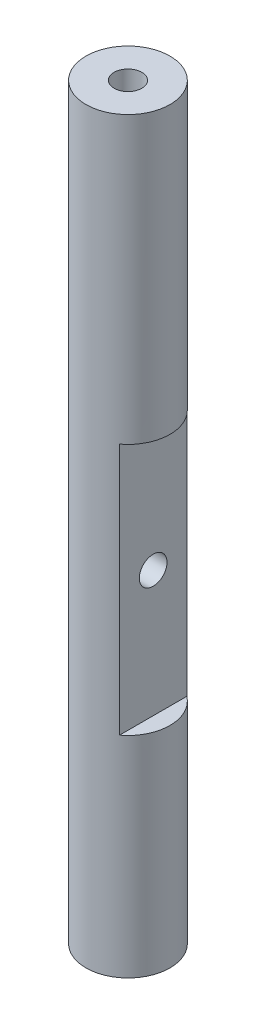
from build123d import *

# Parameters (mm, degrees)
SKETCH_1_R             = 5
EXTRUDE_1_DEPTH        = 89
HOLE_WIZARD_M4_2_D     = 3.3
HOLE_WIZARD_M4_2_DEPTH = 11.5
HOLE_WIZARD_M4_2_TIP   = 0.991420021
HOLE_WIZARD_M4_1_D     = 3.3
HOLE_WIZARD_M4_1_DEPTH = 11.5
HOLE_WIZARD_M4_1_TIP   = 0.991420021
CUT_EXTRUDE_START      = 5
SKETCH_7_W             = 26.609090492
SKETCH_7_H             = 30
CUT_EXTRUDE_1_DEPTH    = 2
HOLE_WIZARD_M4_3_D     = 3.3
HOLE_WIZARD_M4_3_DEPTH = 11.5
HOLE_WIZARD_M4_3_TIP   = 0.991420021


with BuildPart() as part:
    # 草图1 → 凸台-拉伸1 (new body)
    with BuildSketch(Plane(origin=(0, 0, 0), x_dir=(1, 0, 0), z_dir=(0, 1, 0))):
        with Locations(Location((0, 0, 0), (0, 0, 270))):
            Circle(SKETCH_1_R)
    extrude(amount=EXTRUDE_1_DEPTH)

    # M4 螺纹孔2
    with Locations(Plane(origin=(0, 89, 0), x_dir=(1, 0, 0), z_dir=(0, 1, 0))):
        with Locations((0, 0)):
            Hole(HOLE_WIZARD_M4_2_D / 2, depth=HOLE_WIZARD_M4_2_DEPTH)
            with Locations((0, 0, -(HOLE_WIZARD_M4_2_DEPTH + HOLE_WIZARD_M4_2_TIP / 2))):  # 118° drill point
                Cone(0, HOLE_WIZARD_M4_2_D / 2, HOLE_WIZARD_M4_2_TIP, mode=Mode.SUBTRACT)

    # M4 螺纹孔1
    with Locations(Plane(origin=(0, 0, 0), x_dir=(-1, 0, 0), z_dir=(0, -1, 0))):
        with Locations((0, 0)):
            Hole(HOLE_WIZARD_M4_1_D / 2, depth=HOLE_WIZARD_M4_1_DEPTH)
            with Locations((0, 0, -(HOLE_WIZARD_M4_1_DEPTH + HOLE_WIZARD_M4_1_TIP / 2))):  # 118° drill point
                Cone(0, HOLE_WIZARD_M4_1_D / 2, HOLE_WIZARD_M4_1_TIP, mode=Mode.SUBTRACT)

    # 草图7 → 切除-拉伸1 (cut)
    with BuildSketch(Plane(origin=(0, 0, 0), x_dir=(0, 0, -1), z_dir=(1, 0, 0)).offset(CUT_EXTRUDE_START)):
        with Locations((0, 40)):
            Rectangle(SKETCH_7_W, SKETCH_7_H)
    extrude(amount=-CUT_EXTRUDE_1_DEPTH, mode=Mode.SUBTRACT)

    # M4 螺纹孔3
    with Locations(Plane(origin=(3, 0, 0), x_dir=(0, 0, -1), z_dir=(1, 0, 0))):
        with Locations((0, 40)):
            Hole(HOLE_WIZARD_M4_3_D / 2, depth=HOLE_WIZARD_M4_3_DEPTH)
            with Locations((0, 0, -(HOLE_WIZARD_M4_3_DEPTH + HOLE_WIZARD_M4_3_TIP / 2))):  # 118° drill point
                Cone(0, HOLE_WIZARD_M4_3_D / 2, HOLE_WIZARD_M4_3_TIP, mode=Mode.SUBTRACT)


solid = part.part
